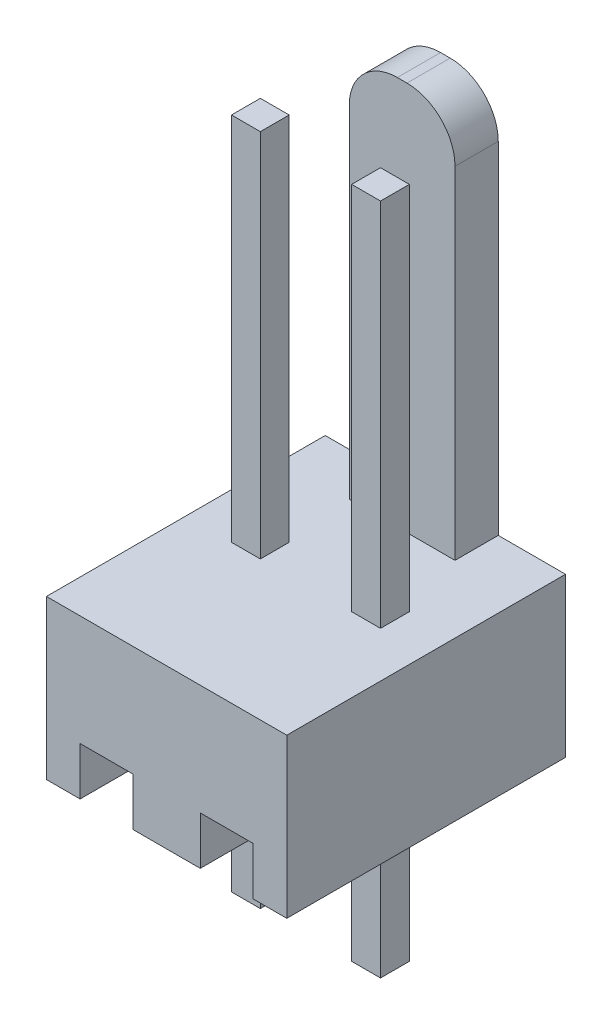
from build123d import *

# Parameters (mm, degrees)
CROQUIS1_W                   = 5
CROQUIS1_H                   = 5.8
SALIENTE_EXTRUIR1_DEPTH      = 3.3
CROQUIS4_W                   = 1.1
CROQUIS4_H                   = 5.8
CORTAR_EXTRUIR1_DEPTH        = 1
CROQUIS5_W                   = 2.2
CROQUIS5_H                   = 0.9
SALIENTE_EXTRUIR2_DEPTH      = 8.1
REDONDEO4_R                  = 1
REDONDEO5_R                  = 1
SALIENTE_EXTRUIR3_DEPTH      = 4
SALIENTE_EXTRUIR3_DEPTH_BACK = 10
CROQUIS6_W                   = 0.6
CROQUIS6_H                   = 0.6


with BuildPart() as part:
    # Croquis1 → Saliente-Extruir1 (new body)
    with BuildSketch(Plane(origin=(0, 0, 0), x_dir=(1, 0, 0), z_dir=(0, 1, 0))):
        Rectangle(CROQUIS1_W, CROQUIS1_H)
    extrude(amount=SALIENTE_EXTRUIR1_DEPTH)

    # Croquis4 → Cortar-Extruir1 (cut)
    with BuildSketch(Plane.XZ):
        with Locations((-1.25, 0)):
            Rectangle(CROQUIS4_W, CROQUIS4_H)
        with Locations((1.25, 0)):
            Rectangle(CROQUIS4_W, CROQUIS4_H)
    extrude(amount=-CORTAR_EXTRUIR1_DEPTH, mode=Mode.SUBTRACT)

    # Croquis5 → Saliente-Extruir2 (add)
    with BuildSketch(Plane(origin=(0, 3.3, 0), x_dir=(1, 0, 0), z_dir=(0, 1, 0))):
        with Locations((0, 2.45)):
            Rectangle(CROQUIS5_W, CROQUIS5_H)
    extrude(amount=SALIENTE_EXTRUIR2_DEPTH)

    # Redondeo4
    redondeo4_edges = [part.edges().sort_by_distance(p)[0] for p in [
        (-1.1, 11.4, -2.45),
    ]]
    fillet(redondeo4_edges, radius=REDONDEO4_R)

    # Redondeo5
    redondeo5_edges = [part.edges().sort_by_distance(p)[0] for p in [
        (1.1, 11.4, -2.45),
    ]]
    fillet(redondeo5_edges, radius=REDONDEO5_R)

    # Croquis6 → Saliente-Extruir3 (add, two sides: drawn at the far end of the back side and taken through both)
    with BuildSketch(Plane.XZ.offset(-1).offset(-SALIENTE_EXTRUIR3_DEPTH_BACK)):
        with Locations((1.25, -0.3)):
            Rectangle(CROQUIS6_W, CROQUIS6_H)
        with Locations((-1.25, -0.3)):
            Rectangle(CROQUIS6_W, CROQUIS6_H)
    extrude(amount=SALIENTE_EXTRUIR3_DEPTH + SALIENTE_EXTRUIR3_DEPTH_BACK)


solid = part.part
